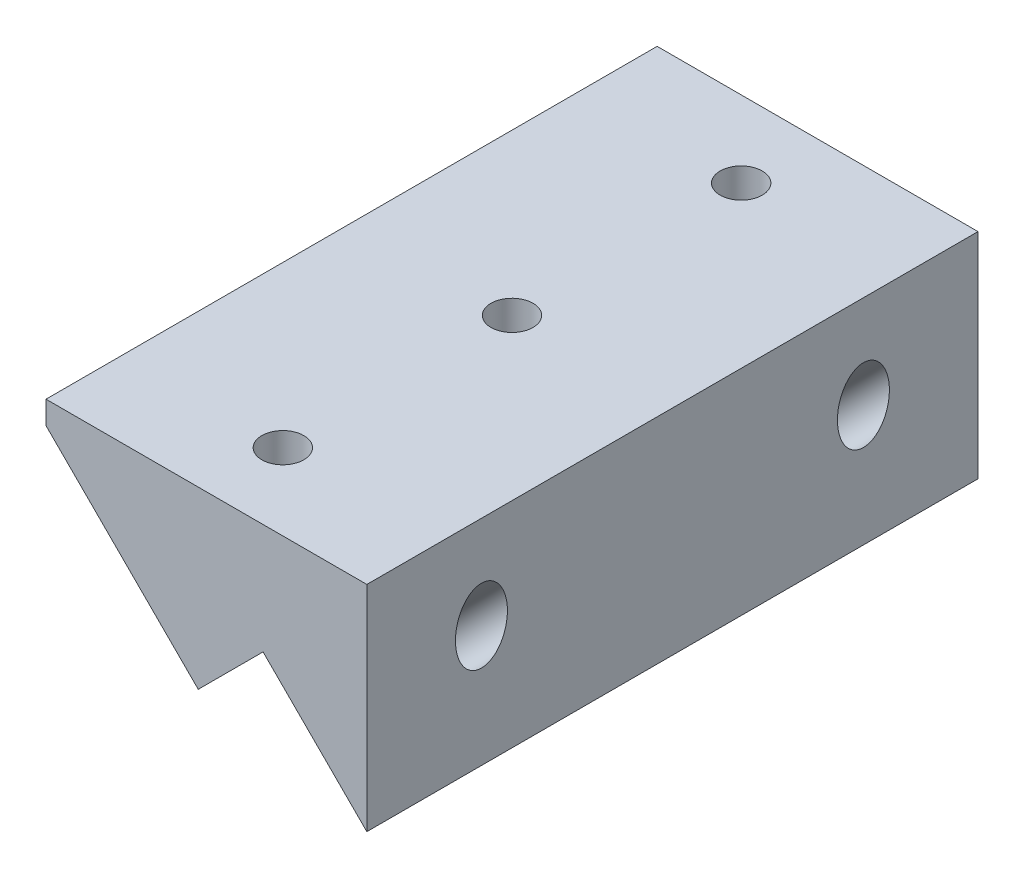
from build123d import *

# Parameters (mm, degrees)
SKETCH_1_W                = 42
SKETCH_1_H                = 30
EXTRUDE_1_DEPTH           = 40
CUT_EXTRUDE_1_DEPTH       = 85.059502735
HOLE_WIZARD_1_D           = 5.5
HOLE_WIZARD_1_CBORE_D     = 10
HOLE_WIZARD_1_CBORE_DEPTH = 23
CUT_EXTRUDE_2_DEPTH       = 85.059502735
HOLE_WIZARD_M8_1_D        = 6.8
HOLE_WIZARD_M8_1_DEPTH    = 19.75
HOLE_WIZARD_M8_1_TIP      = 2.042926105


with BuildPart() as part:
    # 草图1 → 凸台-拉伸1 (new, symmetric)
    with BuildSketch(Plane.XY):
        Rectangle(SKETCH_1_W, SKETCH_1_H)
    extrude(amount=EXTRUDE_1_DEPTH, both=True)

    # 草图2 → 切除-拉伸1 (cut, through all)
    with BuildSketch(Plane.XY.offset(40)):
        Polygon((-21, 12), (6, -15), (-21, -15), align=None)
    extrude(amount=-CUT_EXTRUDE_1_DEPTH, mode=Mode.SUBTRACT)

    # 打孔尺寸根据内六角圆柱头螺钉的类型1 (through all)
    with Locations(Plane(origin=(0, -15, 0), x_dir=(-1, 0, 0), z_dir=(0, -1, 0))):
        with Locations((0, -30), (0, 30), (0, 0)):
            CounterBoreHole(HOLE_WIZARD_1_D / 2, HOLE_WIZARD_1_CBORE_D / 2, HOLE_WIZARD_1_CBORE_DEPTH)

    # 草图3 → 切除-拉伸2 (cut, through all)
    with BuildSketch(Plane.XY.offset(40)):
        Polygon((-1.071067812, -7.928932188), (7.414213562, 0.556349186), (22.970562748, -15), (6, -15), align=None)
    extrude(amount=-CUT_EXTRUDE_2_DEPTH, mode=Mode.SUBTRACT)

    # M8 螺纹孔1
    with Locations(Plane(origin=(3.985281374, 3.985281374, 0), x_dir=(-0.7071067811865477, 0.7071067811865474, 0), z_dir=(-0.7071067811865474, -0.7071067811865477, 0))):
        with Locations((-12.849242405, 25), (-12.849242405, -25)):
            Hole(HOLE_WIZARD_M8_1_D / 2, depth=HOLE_WIZARD_M8_1_DEPTH)
            with Locations((0, 0, -(HOLE_WIZARD_M8_1_DEPTH + HOLE_WIZARD_M8_1_TIP / 2))):  # 118° drill point
                Cone(0, HOLE_WIZARD_M8_1_D / 2, HOLE_WIZARD_M8_1_TIP, mode=Mode.SUBTRACT)


solid = part.part
